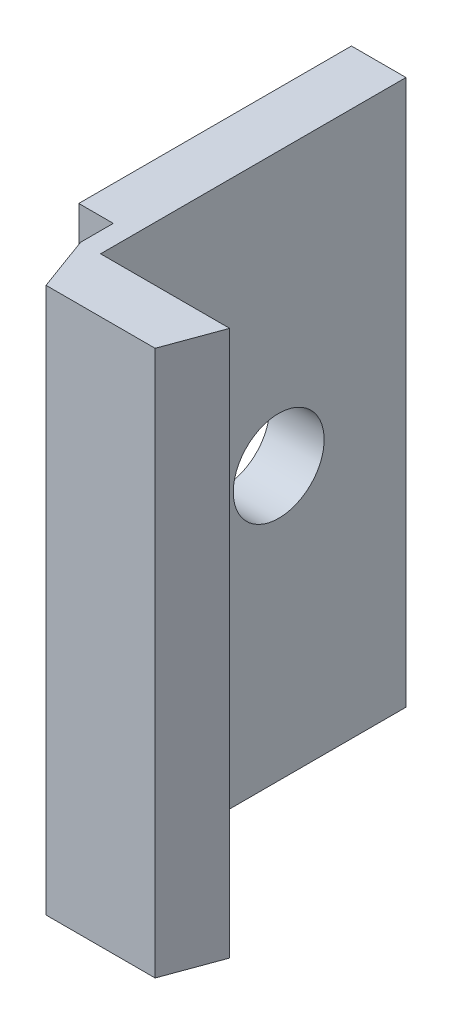
from build123d import *

# Parameters (mm, degrees)
EXTRUDE_1_DEPTH          = 30
CUT_EXTRUDE_1_DEPTH      = 36.836433974
CUT_EXTRUDE_1_DEPTH_BACK = 36.836433974
SKETCH_2_R               = 2.5


with BuildPart() as part:
    # 草图1 → 凸台-拉伸1 (new body)
    with BuildSketch(Plane(origin=(0, 0, 0), x_dir=(1, 0, 0), z_dir=(0, 1, 0))):
        Polygon((0, 1.8), (0, 0), (1.1, 0), (1.1, 16.8), (-1.9, 16.8), (-1.9, 1.8), align=None)
        Polygon((1.1, -3), (7.1, -3), (8.2, 0), (0, 0), align=None)
    extrude(amount=EXTRUDE_1_DEPTH)

    # 草图2 → 切除-拉伸1 (cut, two sides: drawn at the far end of the back side and taken through both)
    with BuildSketch(Plane.ZY.offset(1.9).offset(-CUT_EXTRUDE_1_DEPTH_BACK)):
        with Locations((-9.8, 15)):
            Circle(SKETCH_2_R)
    extrude(amount=CUT_EXTRUDE_1_DEPTH + CUT_EXTRUDE_1_DEPTH_BACK, mode=Mode.SUBTRACT)


solid = part.part
